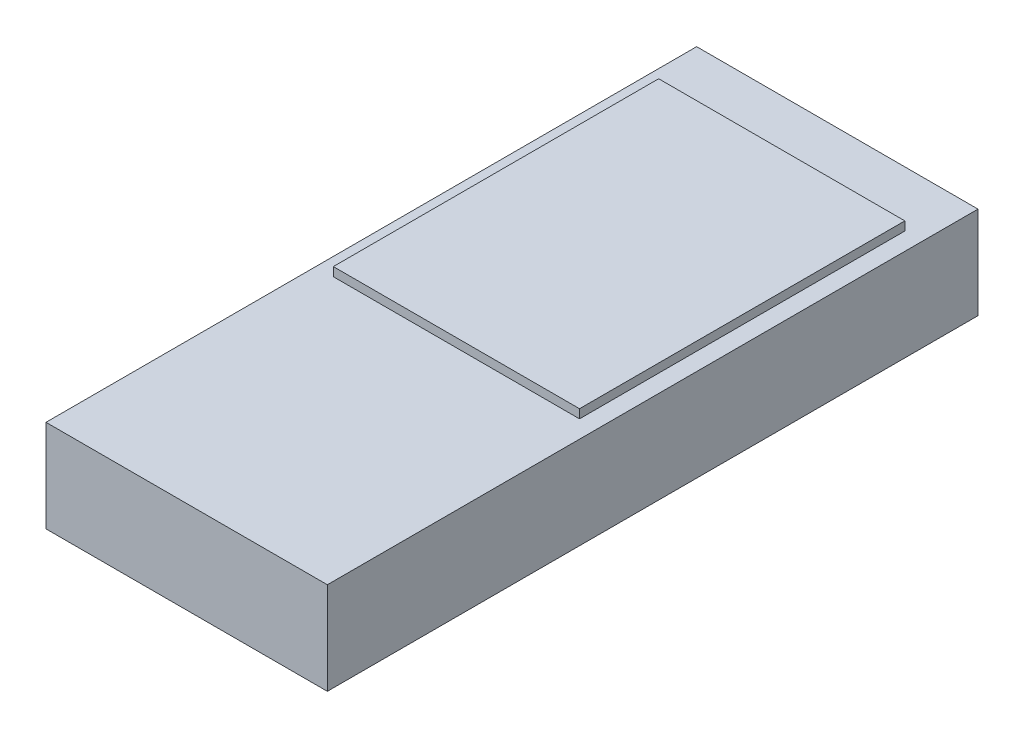
from build123d import *

# Parameters (mm, degrees)
SKETCH2_W           = 81.28
SKETCH2_H           = 187.96
BOSS_EXTRUDE1_DEPTH = 26.67
SKETCH4_W           = 71.12
SKETCH4_H           = 93.98
BOSS_EXTRUDE2_DEPTH = 2.54


with BuildPart() as part:
    # Sketch2 → Boss-Extrude1 (new body)
    with BuildSketch(Plane(origin=(0, 0, 0), x_dir=(1, 0, 0), z_dir=(0, 1, 0))):
        with Locations((0, -93.98)):
            Rectangle(SKETCH2_W, SKETCH2_H)
    extrude(amount=BOSS_EXTRUDE1_DEPTH)

    # Sketch4 → Boss-Extrude2 (add)
    with BuildSketch(Plane(origin=(0, 26.67, 0), x_dir=(1, 0, 0), z_dir=(0, 1, 0))):
        with Locations((0, -63.045146039)):
            Rectangle(SKETCH4_W, SKETCH4_H)
    extrude(amount=BOSS_EXTRUDE2_DEPTH)


solid = part.part
